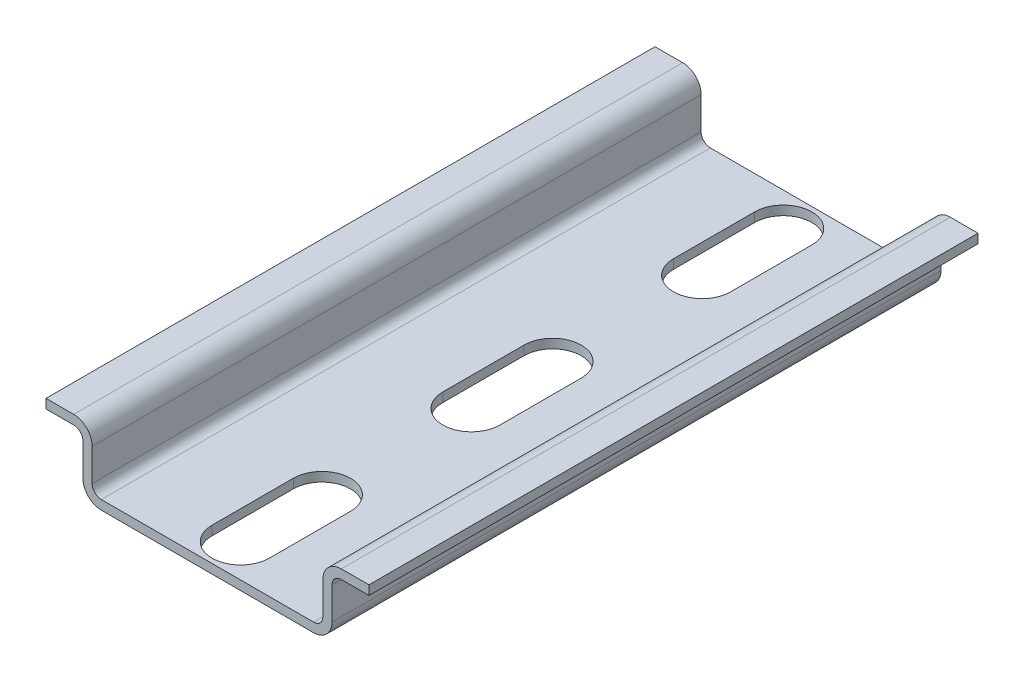
from build123d import *

# Parameters (mm, degrees)
EXTRUDE_1_DEPTH        = 220
CUT_EXTRUDE_1_DEPTH    = 1
PATTERN_LINEAR_3_COUNT = 8
PATTERN_LINEAR_3_PITCH = 25
CUT_EXTRUDE_5_DEPTH    = 9.5
CUT_EXTRUDE_START      = -19.5
CUT_EXTRUDE_6_DEPTH    = 19.5
SKETCH_6_W             = 72.426298227
SKETCH_6_H             = 150
CUT_EXTRUDE_7_DEPTH    = 10


with BuildPart() as part:
    # Эскиз1 → Вытянуть1 (new body)
    with BuildSketch(Plane.XY):
        with BuildLine():
            Line((-17.5, 6.5), (-14.5, 6.5))
            ThreePointArc((-14.5, 6.5), (-13.792893219, 6.207106781), (-13.5, 5.5))
            Line((-13.5, 5.5), (-13.5, 2))
            ThreePointArc((-13.5, 2), (-12.914213562, 0.585786438), (-11.5, 0))
            Line((-11.5, 0), (11.5, 0))
            ThreePointArc((11.5, 0), (12.914213562, 0.585786438), (13.5, 2))
            Line((13.5, 2), (13.5, 5.5))
            ThreePointArc((13.5, 5.5), (13.792893219, 6.207106781), (14.5, 6.5))
            Line((14.5, 6.5), (17.5, 6.5))
            Line((17.5, 6.5), (17.5, 7.5))
            Line((17.5, 7.5), (14.5, 7.5))
            ThreePointArc((14.5, 7.5), (13.085786438, 6.914213562), (12.5, 5.5))
            Line((12.5, 5.5), (12.5, 2))
            ThreePointArc((12.5, 2), (12.207106781, 1.292893219), (11.5, 1))
            Line((11.5, 1), (-11.5, 1))
            ThreePointArc((-11.5, 1), (-12.207106781, 1.292893219), (-12.5, 2))
            Line((-12.5, 2), (-12.5, 5.5))
            ThreePointArc((-12.5, 5.5), (-13.085786438, 6.914213562), (-14.5, 7.5))
            Line((-14.5, 7.5), (-17.5, 7.5))
            Line((-17.5, 7.5), (-17.5, 6.5))
        make_face()
    extrude(amount=EXTRUDE_1_DEPTH)

    # Эскиз2 → Вырез-Вытянуть1 (cut)
    with BuildSketch(Plane(origin=(0, 1, 0), x_dir=(-1, 0, 0), z_dir=(0, 1, 0))):
        with BuildLine():
            Line((3.1, 21.9), (3.1, 13.1))
            ThreePointArc((3.1, 13.1), (0, 10), (-3.1, 13.1))
            Line((-3.1, 13.1), (-3.1, 21.9))
            ThreePointArc((-3.1, 21.9), (0, 25), (3.1, 21.9))
        make_face()
    cut_extrude_1 = extrude(amount=-CUT_EXTRUDE_1_DEPTH, mode=Mode.SUBTRACT)

    # Линейный массив3: Вырез-Вытянуть1 ×8
    with Locations(*[(0, 0, i * PATTERN_LINEAR_3_PITCH) for i in range(1, PATTERN_LINEAR_3_COUNT)]):
        add(cut_extrude_1, mode=Mode.SUBTRACT)

    # Эскиз3 → Вырез-Вытянуть5 (cut)
    with BuildSketch(Plane(origin=(0, 0, 0), x_dir=(-1, 0, 0), z_dir=(0, 0, -1))):
        with BuildLine():
            Line((17.5, 6.5), (17.5, 7.5))
            Line((17.5, 7.5), (14.5, 7.5))
            ThreePointArc((14.5, 7.5), (13.085786438, 6.914213562), (12.5, 5.5))
            Line((12.5, 5.5), (12.5, 2))
            ThreePointArc((12.5, 2), (12.207106781, 1.292893219), (11.5, 1))
            Line((11.5, 1), (-11.5, 1))
            ThreePointArc((-11.5, 1), (-12.207106781, 1.292893219), (-12.5, 2))
            Line((-12.5, 2), (-12.5, 5.5))
            ThreePointArc((-12.5, 5.5), (-13.085786438, 6.914213562), (-14.5, 7.5))
            Line((-14.5, 7.5), (-17.5, 7.5))
            Line((-17.5, 7.5), (-17.5, 6.5))
            Line((-17.5, 6.5), (-14.5, 6.5))
            ThreePointArc((-14.5, 6.5), (-13.792893219, 6.207106781), (-13.5, 5.5))
            Line((-13.5, 5.5), (-13.5, 2))
            ThreePointArc((-13.5, 2), (-12.914213562, 0.585786438), (-11.5, 0))
            Line((-11.5, 0), (11.5, 0))
            ThreePointArc((11.5, 0), (12.914213562, 0.585786438), (13.5, 2))
            Line((13.5, 2), (13.5, 5.5))
            ThreePointArc((13.5, 5.5), (13.792893219, 6.207106781), (14.5, 6.5))
            Line((14.5, 6.5), (17.5, 6.5))
        make_face()
    extrude(amount=-CUT_EXTRUDE_5_DEPTH, mode=Mode.SUBTRACT)

    # Эскиз5 → Вырез-Вытянуть6 (cut)
    with BuildSketch(Plane.XY.offset(220).offset(CUT_EXTRUDE_START)):
        with BuildLine():
            Line((-17.5, 7.5), (-17.5, 6.5))
            Line((-17.5, 6.5), (-14.5, 6.5))
            ThreePointArc((-14.5, 6.5), (-13.792893219, 6.207106781), (-13.5, 5.5))
            Line((-13.5, 5.5), (-13.5, 2))
            ThreePointArc((-13.5, 2), (-12.914213562, 0.585786438), (-11.5, 0))
            Line((-11.5, 0), (11.5, 0))
            ThreePointArc((11.5, 0), (12.914213562, 0.585786438), (13.5, 2))
            Line((13.5, 2), (13.5, 5.5))
            ThreePointArc((13.5, 5.5), (13.792893219, 6.207106781), (14.5, 6.5))
            Line((14.5, 6.5), (17.5, 6.5))
            Line((17.5, 6.5), (17.5, 7.5))
            Line((17.5, 7.5), (14.5, 7.5))
            ThreePointArc((14.5, 7.5), (13.085786438, 6.914213562), (12.5, 5.5))
            Line((12.5, 5.5), (12.5, 2))
            ThreePointArc((12.5, 2), (12.207106781, 1.292893219), (11.5, 1))
            Line((11.5, 1), (-11.5, 1))
            ThreePointArc((-11.5, 1), (-12.207106781, 1.292893219), (-12.5, 2))
            Line((-12.5, 2), (-12.5, 5.5))
            ThreePointArc((-12.5, 5.5), (-13.085786438, 6.914213562), (-14.5, 7.5))
            Line((-14.5, 7.5), (-17.5, 7.5))
        make_face()
    extrude(amount=CUT_EXTRUDE_6_DEPTH, mode=Mode.SUBTRACT)

    # Эскиз6 → Вырез-Вытянуть7 (cut)
    with BuildSketch(Plane.XZ):
        with Locations((4.055872701, 59.5)):
            Rectangle(SKETCH_6_W, SKETCH_6_H)
    extrude(amount=-CUT_EXTRUDE_7_DEPTH, mode=Mode.SUBTRACT)


solid = part.part
